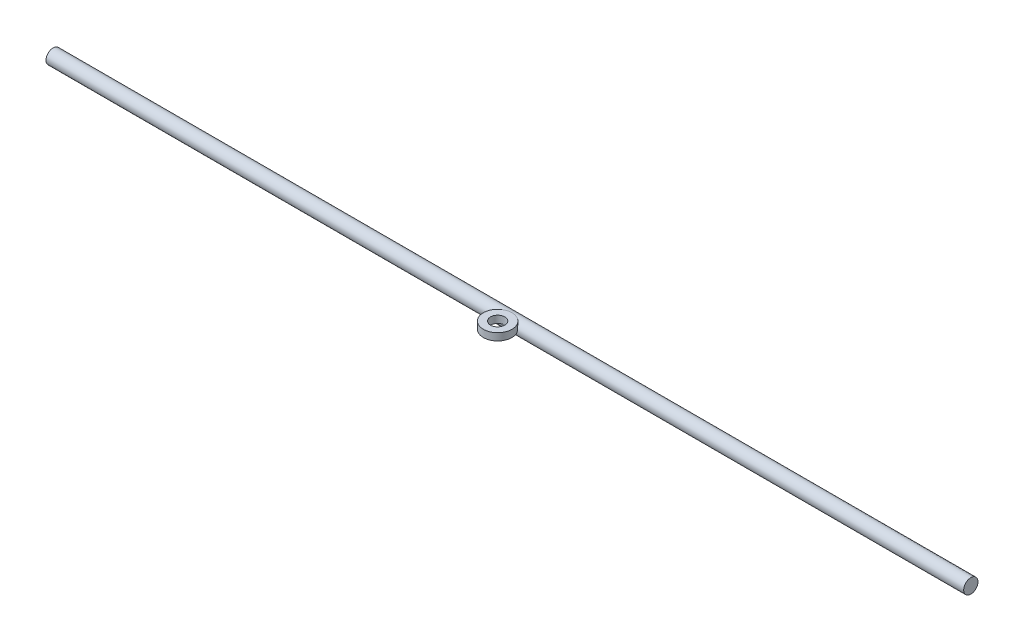
from build123d import *

# Parameters (mm, degrees)
BALAYAGE1_PROFILE_R = 5
ESQUISSE2_R         = 10
ESQUISSE2_R_2       = 5
BOSS_EXTRU_1_DEPTH  = 5


with BuildPart() as part:
    # Balayage1: sweep along a path in Esquisse1
    with BuildLine(Plane.XY) as balayage1_path:
        Line((-320, 0), (320, 0))
    # Balayage1 profile (on start of the path) → Balayage1 (sweep)
    with BuildSketch(Plane(origin=(-320, 0, 0), x_dir=(0, 0, 1), z_dir=(1, 0, 0))):
        Circle(BALAYAGE1_PROFILE_R)
    sweep(path=balayage1_path.line)

    # Esquisse2 → Boss.-Extru.1 (add)
    with BuildSketch(Plane(origin=(0, 0, 0), x_dir=(1, 0, 0), z_dir=(0, 1, 0))):
        with Locations((0, -10)):
            Circle(ESQUISSE2_R)
        with Locations(Location((0, -10, 0), (0, 0, 90))):
            Circle(ESQUISSE2_R_2, mode=Mode.SUBTRACT)
    extrude(amount=BOSS_EXTRU_1_DEPTH)


solid = part.part
